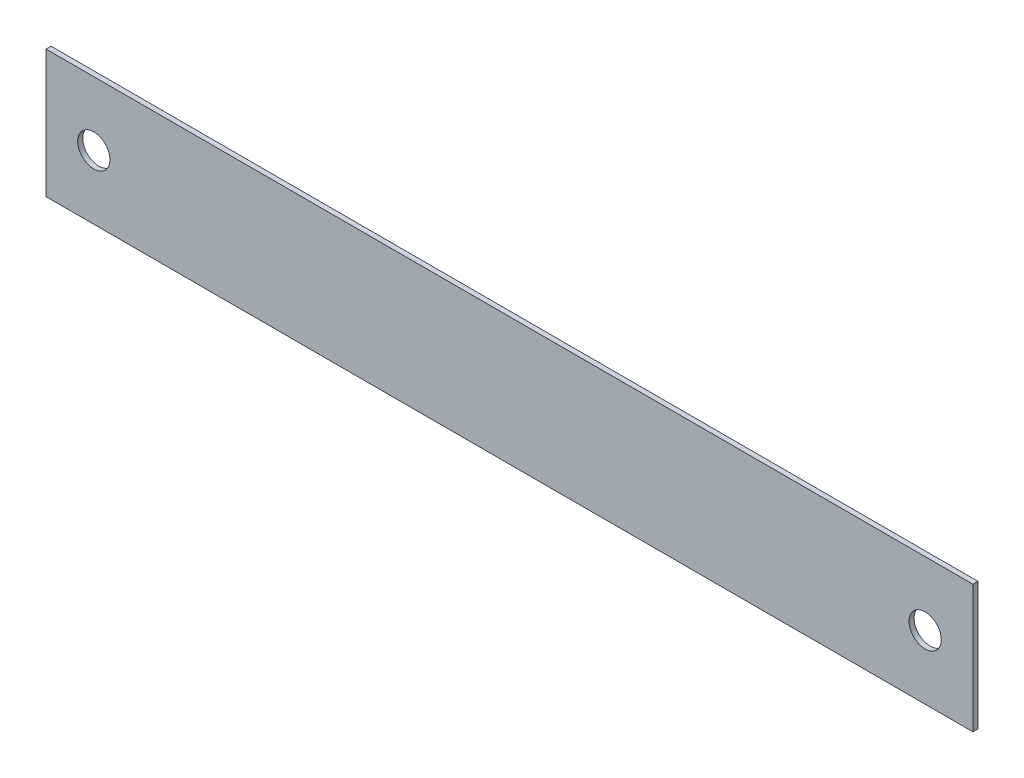
from build123d import *

# Parameters (mm, degrees)
SKETCH1_W           = 92.1
SKETCH1_H           = 12.7
SKETCH1_R           = 1.6
BOSS_EXTRUDE1_DEPTH = 0.5


with BuildPart() as part:
    # Sketch1 → Boss-Extrude1 (new body)
    with BuildSketch(Plane.XY):
        with Locations((41.3, 0)):
            Rectangle(SKETCH1_W, SKETCH1_H)
        Circle(SKETCH1_R, mode=Mode.SUBTRACT)
        with Locations((82.6, 0)):
            Circle(SKETCH1_R, mode=Mode.SUBTRACT)
    extrude(amount=BOSS_EXTRUDE1_DEPTH)


solid = part.part
